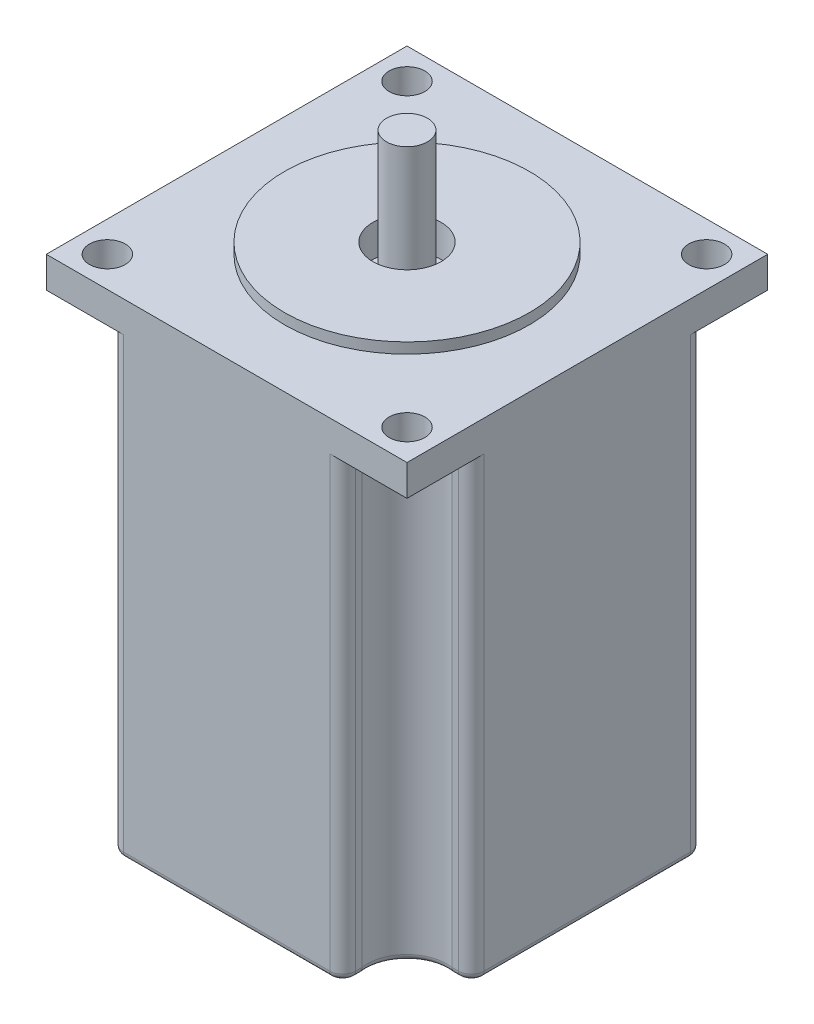
from build123d import *

# Parameters (mm, degrees)
ESBO_O1_W                = 56.1
ESBO_O1_H                = 56.1
RESSALTO_EXTRUS_O1_DEPTH = 75.5
ESBO_O2_R                = 19.035
RESSALTO_EXTRUS_O2_DEPTH = 1.65
ESBO_O3_R                = 5.3
CORTE_EXTRUS_O1_DEPTH    = 5
ESBO_O4_R                = 3.185
RESSALTO_EXTRUS_O3_DEPTH = 20.08
CORTE_EXTRUS_O2_DEPTH    = 70.67
ESBO_O6_R                = 2.78
CORTE_EXTRUS_O3_DEPTH    = 4.83
ESBO_O7_R                = 3.185
CORTE_EXTRUS_O4_DEPTH    = 5
FILETE1_R                = 2
FILETE2_R                = 1


with BuildPart() as part:
    # Esboço1 → Ressalto-extrusão1 (new body)
    with BuildSketch(Plane(origin=(0, 0, 0), x_dir=(1, 0, 0), z_dir=(0, 1, 0))):
        Rectangle(ESBO_O1_W, ESBO_O1_H)
    extrude(amount=RESSALTO_EXTRUS_O1_DEPTH)

    # Esboço2 → Ressalto-extrusão2 (add)
    with BuildSketch(Plane(origin=(0, 75.5, 0), x_dir=(1, 0, 0), z_dir=(0, 1, 0))):
        with Locations(Location((0, 0, 0), (0, 0, 270))):
            Circle(ESBO_O2_R)
    extrude(amount=RESSALTO_EXTRUS_O2_DEPTH)

    # Esboço3 → Corte-extrusão1 (cut)
    with BuildSketch(Plane(origin=(0, 77.15, 0), x_dir=(1, 0, 0), z_dir=(0, 1, 0))):
        with Locations(Location((0, 0, 0), (0, 0, 270))):
            Circle(ESBO_O3_R)
    extrude(amount=-CORTE_EXTRUS_O1_DEPTH, mode=Mode.SUBTRACT)

    # Esboço4 → Ressalto-extrusão3 (add)
    with BuildSketch(Plane(origin=(0, 72.15, 0), x_dir=(1, 0, 0), z_dir=(0, 1, 0))):
        with Locations(Location((0, 0, 0), (0, 0, 270))):
            Circle(ESBO_O4_R)
    extrude(amount=RESSALTO_EXTRUS_O3_DEPTH)

    # Esboço5 → Corte-extrusão2 (cut)
    with BuildSketch(Plane.XZ):
        with BuildLine():
            Line((28.05, 28.05), (18.05, 28.05))
            Line((18.05, 28.05), (18.05, 25.05))
            ThreePointArc((18.05, 25.05), (19.80484704, 19.80484704), (25.05, 18.05))
            Line((25.05, 18.05), (28.05, 18.05))
            Line((28.05, 18.05), (28.05, 28.05))
        make_face()
        with BuildLine():
            Line((-28.05, 28.05), (-28.05, 18.05))
            Line((-28.05, 18.05), (-25.05, 18.05))
            ThreePointArc((-25.05, 18.05), (-19.80484704, 19.80484704), (-18.05, 25.05))
            Line((-18.05, 25.05), (-18.05, 28.05))
            Line((-18.05, 28.05), (-28.05, 28.05))
        make_face()
        with BuildLine():
            Line((-25.05, -18.05), (-28.05, -18.05))
            Line((-28.05, -18.05), (-28.05, -28.05))
            Line((-28.05, -28.05), (-18.05, -28.05))
            Line((-18.05, -28.05), (-18.05, -25.05))
            ThreePointArc((-18.05, -25.05), (-19.80484704, -19.80484704), (-25.05, -18.05))
        make_face()
        with BuildLine():
            Line((18.05, -25.05), (18.05, -28.05))
            Line((18.05, -28.05), (28.05, -28.05))
            Line((28.05, -28.05), (28.05, -18.05))
            Line((28.05, -18.05), (25.05, -18.05))
            ThreePointArc((25.05, -18.05), (19.80484704, -19.80484704), (18.05, -25.05))
        make_face()
    extrude(amount=-CORTE_EXTRUS_O2_DEPTH, mode=Mode.SUBTRACT)

    # Esboço6 → Corte-extrusão3 (cut)
    with BuildSketch(Plane(origin=(0, 75.5, 0), x_dir=(1, 0, 0), z_dir=(0, 1, 0))):
        with Locations(Location((-23.3, 23.3, 0), (0, 0, 270))):
            Circle(ESBO_O6_R)
        with Locations(Location((-23.3, -23.3, 0), (0, 0, 90))):
            Circle(ESBO_O6_R)
        with Locations(Location((23.3, 23.3, 0), (0, 0, 90))):
            Circle(ESBO_O6_R)
        with Locations(Location((23.3, -23.3, 0), (0, 0, 270))):
            Circle(ESBO_O6_R)
    extrude(amount=-CORTE_EXTRUS_O3_DEPTH, mode=Mode.SUBTRACT)

    # Esboço7 → Corte-extrusão4 (cut)
    with BuildSketch(Plane.XZ):
        with Locations(Location((0, 0, 0), (0, 0, 90))):
            Circle(ESBO_O7_R)
    extrude(amount=-CORTE_EXTRUS_O4_DEPTH, mode=Mode.SUBTRACT)

    # Filete1
    filete1_edges = [part.edges().sort_by_distance(p)[0] for p in [
        (18.05, 35.335, 28.05),
        (28.05, 35.335, 18.05),
        (-28.05, 35.335, 18.05),
        (-18.05, 35.335, 28.05),
        (-18.05, 35.335, -28.05),
        (-28.05, 35.335, -18.05),
        (28.05, 35.335, -18.05),
        (18.05, 35.335, -28.05),
    ]]
    fillet(filete1_edges, radius=FILETE1_R)

    # Filete2
    filete2_edges = [part.edges().sort_by_distance(p)[0] for p in [
        (0, 0, -3.185),
        (28.05, 0, 0),
        (18.05, 0, 25.55),
        (0, 0, 28.05),
        (-18.05, 0, 25.55),
        (-25.55, 0, 18.05),
        (-28.05, 0, 0),
        (-25.55, 0, -18.05),
        (0, 0, -28.05),
        (27.464213562, 0, 17.464213562),
        (17.464213562, 0, 27.464213562),
        (-17.464213562, 0, 27.464213562),
        (-27.464213562, 0, 17.464213562),
        (-27.464213562, 0, -17.464213562),
        (-17.464213562, 0, -27.464213562),
        (17.464213562, 0, -27.464213562),
        (27.464213562, 0, -17.464213562),
        (19.80484704, 0, 19.80484704),
        (25.55, 0, 18.05),
        (-19.80484704, 0, 19.80484704),
        (-19.80484704, 0, -19.80484704),
        (-18.05, 0, -25.55),
        (19.80484704, 0, -19.80484704),
        (25.55, 0, -18.05),
        (18.05, 0, -25.55),
    ]]
    fillet(filete2_edges, radius=FILETE2_R)


solid = part.part
